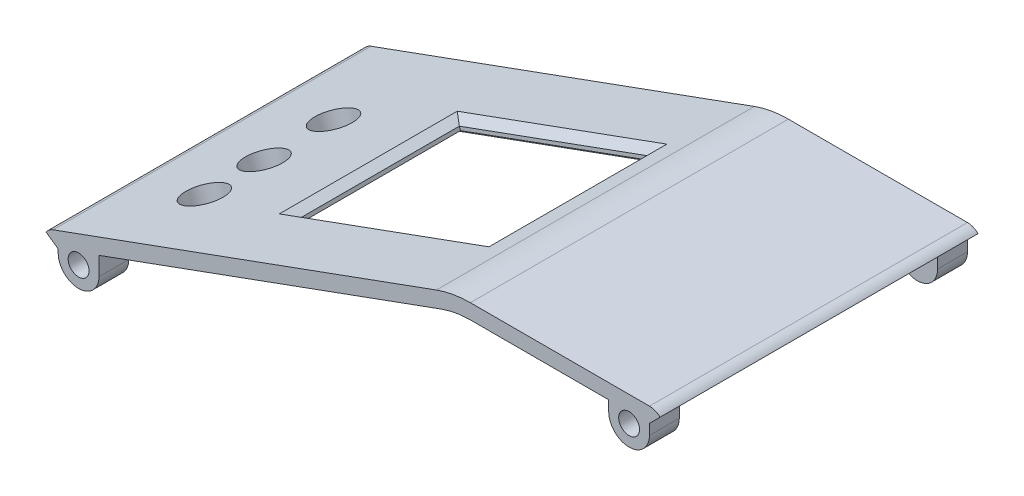
from build123d import *

# Parameters (mm, degrees)
EXTRUDE_1_DEPTH     = 32
EXTRUDE_START       = 32
SKETCH_2_R          = 2.1
EXTRUDE_2_DEPTH     = 6
EXTRUDE_START_2     = -26
SKETCH_2_3_R        = 2.1
EXTRUDE_3_DEPTH     = 6
CUT_EXTRUDE_START   = 32
SKETCH_2_4_R        = 2.1
CUT_EXTRUDE_1_DEPTH = 4
CUT_EXTRUDE_START_2 = -28
SKETCH_2_5_R        = 2.1
CUT_EXTRUDE_2_DEPTH = 4
SKETCH_3_W          = 48.2
SKETCH_3_H          = 35
CUT_EXTRUDE_3_DEPTH = 0.8
SKETCH_4_W          = 41.9
SKETCH_4_H          = 32.8
CUT_EXTRUDE_4_DEPTH = 92.767243652
SKETCH_7_R          = 4
CUT_EXTRUDE_5_DEPTH = 10
SKETCH_8_R          = 2.55
EXTRUDE_4_DEPTH     = 2
SKETCH_9_R          = 1.4
CUT_EXTRUDE_6_DEPTH = 3
CHAMFER_1_SIZE      = 1.5


with BuildPart() as part:
    # Эскиз1 → Бобышка-Вытянуть1 (new, symmetric)
    with BuildSketch(Plane.XY):
        with BuildLine():
            Line((59.5, 80), (23.450862198, 80))
            ThreePointArc((23.450862198, 80), (19.977898644, 79.69615506), (16.610459331, 78.793852416))
            Line((16.610459331, 78.793852416), (-60.52606043, 50.718455248))
            ThreePointArc((-60.52606043, 50.718455248), (-61.326284287, 50.279437406), (-61.957456133, 49.620106694))
            Line((-61.957456133, 49.620106694), (-59.5, 47.899377385))
            Line((-59.5, 47.899377385), (17.636519761, 75.974774553))
            ThreePointArc((17.636519761, 75.974774553), (20.498843177, 76.741731801), (23.450862198, 77))
            Line((23.450862198, 77), (59.5, 77))
            Line((59.5, 77), (61.621320344, 79.121320344))
            ThreePointArc((61.621320344, 79.121320344), (60.648050297, 79.771638598), (59.5, 80))
        make_face()
    extrude(amount=EXTRUDE_1_DEPTH, both=True)

    # Эскиз2 → Бобышка-Вытянуть2 (add)
    # profile 1 of 4: a face of its own
    with BuildSketch(Plane.XY.offset(EXTRUDE_START)):
        with BuildLine():
            Line((51.3, 80), (51.3, 74.9))
            ThreePointArc((51.3, 74.9), (55.4, 70.8), (59.5, 74.9))
            Line((59.5, 74.9), (59.5, 80))
            Line((59.5, 80), (51.3, 80))
        make_face()
        with Locations((55.4, 74.9)):
            Circle(SKETCH_2_R, mode=Mode.SUBTRACT)
    # profile 2 of 4: a face of its own
    with BuildSketch(Plane.XY.offset(EXTRUDE_START)):
        with Locations((55.4, 74.9)):
            Circle(SKETCH_2_R)
    # profile 3 of 4: a face of its own
    with BuildSketch(Plane.XY.offset(EXTRUDE_START)):
        with BuildLine():
            ThreePointArc((-51.3, 47.156882024), (-55.4, 43.056882024), (-59.5, 47.156882024))
            Line((-59.5, 47.156882024), (-59.5, 51.091910703))
            Line((-59.5, 51.091910703), (-51.3, 54.076466624))
            Line((-51.3, 54.076466624), (-51.3, 47.156882024))
        make_face()
        with Locations((-55.4, 47.156882024)):
            Circle(SKETCH_2_R, mode=Mode.SUBTRACT)
    # profile 4 of 4: a face of its own
    with BuildSketch(Plane.XY.offset(EXTRUDE_START)):
        with Locations((-55.4, 47.156882024)):
            Circle(SKETCH_2_R)
    extrude(amount=-EXTRUDE_2_DEPTH)

    # Эскиз2<3> → Бобышка-Вытянуть3 (add)
    # profile 1 of 4: a face of its own
    with BuildSketch(Plane.XY.offset(EXTRUDE_START_2)):
        with BuildLine():
            Line((51.3, 80), (51.3, 74.9))
            ThreePointArc((51.3, 74.9), (55.4, 70.8), (59.5, 74.9))
            Line((59.5, 74.9), (59.5, 80))
            Line((59.5, 80), (51.3, 80))
        make_face()
        with Locations((55.4, 74.9)):
            Circle(SKETCH_2_3_R, mode=Mode.SUBTRACT)
    # profile 2 of 4: a face of its own
    with BuildSketch(Plane.XY.offset(EXTRUDE_START_2)):
        with Locations((55.4, 74.9)):
            Circle(SKETCH_2_3_R)
    # profile 3 of 4: a face of its own
    with BuildSketch(Plane.XY.offset(EXTRUDE_START_2)):
        with BuildLine():
            ThreePointArc((-51.3, 47.156882024), (-55.4, 43.056882024), (-59.5, 47.156882024))
            Line((-59.5, 47.156882024), (-59.5, 51.091910703))
            Line((-59.5, 51.091910703), (-51.3, 54.076466624))
            Line((-51.3, 54.076466624), (-51.3, 47.156882024))
        make_face()
        with Locations((-55.4, 47.156882024)):
            Circle(SKETCH_2_3_R, mode=Mode.SUBTRACT)
    # profile 4 of 4: a face of its own
    with BuildSketch(Plane.XY.offset(EXTRUDE_START_2)):
        with Locations((-55.4, 47.156882024)):
            Circle(SKETCH_2_3_R)
    extrude(amount=-EXTRUDE_3_DEPTH)

    # Эскиз2<4> → Вырез-Вытянуть1 (cut)
    with BuildSketch(Plane.XY.offset(CUT_EXTRUDE_START)):
        with Locations((55.4, 74.9)):
            Circle(SKETCH_2_4_R)
        with Locations((-55.4, 47.156882024)):
            Circle(SKETCH_2_4_R)
    extrude(amount=-CUT_EXTRUDE_1_DEPTH, mode=Mode.SUBTRACT)

    # Эскиз2<5> → Вырез-Вытянуть2 (cut)
    with BuildSketch(Plane.XY.offset(CUT_EXTRUDE_START_2)):
        with Locations((55.4, 74.9)):
            Circle(SKETCH_2_5_R)
        with Locations((-55.4, 47.156882024)):
            Circle(SKETCH_2_5_R)
    extrude(amount=-CUT_EXTRUDE_2_DEPTH, mode=Mode.SUBTRACT)

    # Эскиз3 → Вырез-Вытянуть3 (cut)
    with BuildSketch(Plane(origin=(-22.354740965, 61.419146018, 0), x_dir=(0.9396926207859082, 0.3420201433256692, 0), z_dir=(0.3420201433256692, -0.9396926207859082, 0))):
        with Locations((14.320840982, 0)):
            Rectangle(SKETCH_3_W, SKETCH_3_H)
    extrude(amount=-CUT_EXTRUDE_3_DEPTH, mode=Mode.SUBTRACT)

    # Эскиз4 → Вырез-Вытянуть4 (cut, through all)
    with BuildSketch(Plane(origin=(-22.354740965, 61.419146018, 0), x_dir=(0.9396926207859082, 0.3420201433256692, 0), z_dir=(0.3420201433256692, -0.9396926207859082, 0))):
        with Locations((16.370840982, 0)):
            Rectangle(SKETCH_4_W, SKETCH_4_H)
    extrude(amount=-CUT_EXTRUDE_4_DEPTH, mode=Mode.SUBTRACT)

    # Эскиз7 → Вырез-Вытянуть5 (cut)
    with BuildSketch(Plane(origin=(-23.380801395, 64.238223881, 0), x_dir=(0.9396926207859081, 0.34202014332566955, 0), z_dir=(-0.34202014332566955, 0.9396926207859082, 0))):
        with Locations(Location((-24.429159018, 10.25, 0), (0, 0, 180))):
            Circle(SKETCH_7_R)
        with Locations(Location((-24.414159018, -3.75, 0), (0, 0, 180))):
            Circle(SKETCH_7_R)
        with Locations(Location((-24.414159018, -15.75, 0), (0, 0, 180))):
            Circle(SKETCH_7_R)
    extrude(amount=-CUT_EXTRUDE_5_DEPTH, mode=Mode.SUBTRACT)

    # Эскиз8 → Бобышка-Вытянуть4 (add)
    with BuildSketch(Plane(origin=(-22.354740965, 61.419146018, 0), x_dir=(0.9396926207859081, 0.3420201433256697, 0), z_dir=(0.34202014332566966, -0.939692620785908, 0))):
        with Locations(Location((40.970840982, 15, 0), (0, 0, 180))):
            Circle(SKETCH_8_R)
        with Locations(Location((40.970840982, -15, 0), (0, 0, 180))):
            Circle(SKETCH_8_R)
        with Locations(Location((-36.029159018, -16.5, 0), (0, 0, 180))):
            Circle(SKETCH_8_R)
        with Locations(Location((-36.029159018, 16.5, 0), (0, 0, 180))):
            Circle(SKETCH_8_R)
    extrude(amount=EXTRUDE_4_DEPTH)

    # Эскиз9 → Вырез-Вытянуть6 (cut)
    with BuildSketch(Plane(origin=(-21.670700678, 59.539760777, 0), x_dir=(0.9396926207859104, 0.34202014332566316, 0), z_dir=(0.34202014332566316, -0.9396926207859104, 0))):
        with Locations((40.970840982, -15)):
            Circle(SKETCH_9_R)
        with Locations((40.970840982, 15)):
            Circle(SKETCH_9_R)
        with Locations((-36.029159018, -16.5)):
            Circle(SKETCH_9_R)
        with Locations((-36.029159018, 16.5)):
            Circle(SKETCH_9_R)
    extrude(amount=-CUT_EXTRUDE_6_DEPTH, mode=Mode.SUBTRACT)

    # Фаска1
    chamfer_1_edges = [part.edges().sort_by_distance(p)[0] for p in [
        (-27.683803334, 62.672059257, 0),
        (-7.997242928, 69.83738126, 16.4),
        (11.689317477, 77.002703262, 0),
        (-7.997242928, 69.83738126, -16.4),
    ]]
    chamfer(chamfer_1_edges, length=CHAMFER_1_SIZE)


solid = part.part
